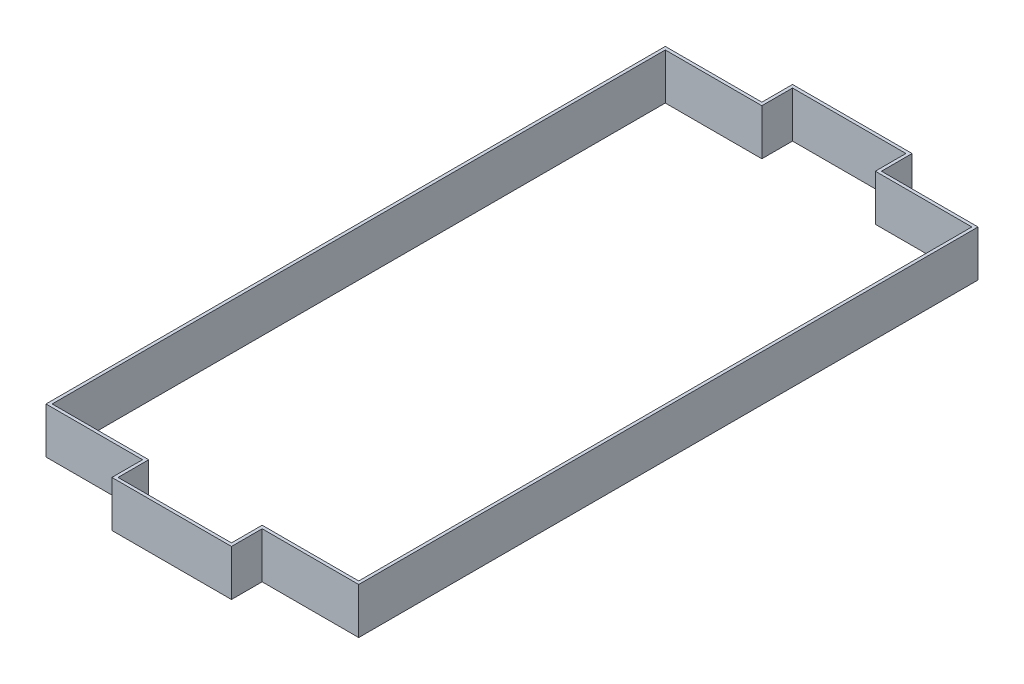
from build123d import *

# Parameters (mm, degrees)
BOSS_EXTRUDE1_DEPTH = 150


with BuildPart() as part:
    # Sketch2 → Boss-Extrude1 (new body)
    with BuildSketch(Plane(origin=(0, 0, 0), x_dir=(1, 0, 0), z_dir=(0, 1, 0))):
        Polygon((315, -100), (315, -10), (305, -10), (305, -110), (695, -110), (695, -10), (685, -10), (685, -100), align=None)
        Polygon((305, 0), (0, 0), (0, 990), (0, 1010), (0, 2000), (305, 2000), (315, 2000), (315, 2010), (305, 2010), (-10, 2010), (-10, -10), (305, -10), (315, -10), (315, 0), align=None)
        Polygon((1000, 1010), (1000, 990), (1000, 0), (695, 0), (685, 0), (685, -10), (695, -10), (1010, -10), (1010, 2010), (695, 2010), (685, 2010), (685, 2000), (695, 2000), (1000, 2000), align=None)
        Polygon((305, 2010), (315, 2010), (315, 2100), (685, 2100), (685, 2010), (695, 2010), (695, 2110), (305, 2110), align=None)
    extrude(amount=BOSS_EXTRUDE1_DEPTH)


solid = part.part
